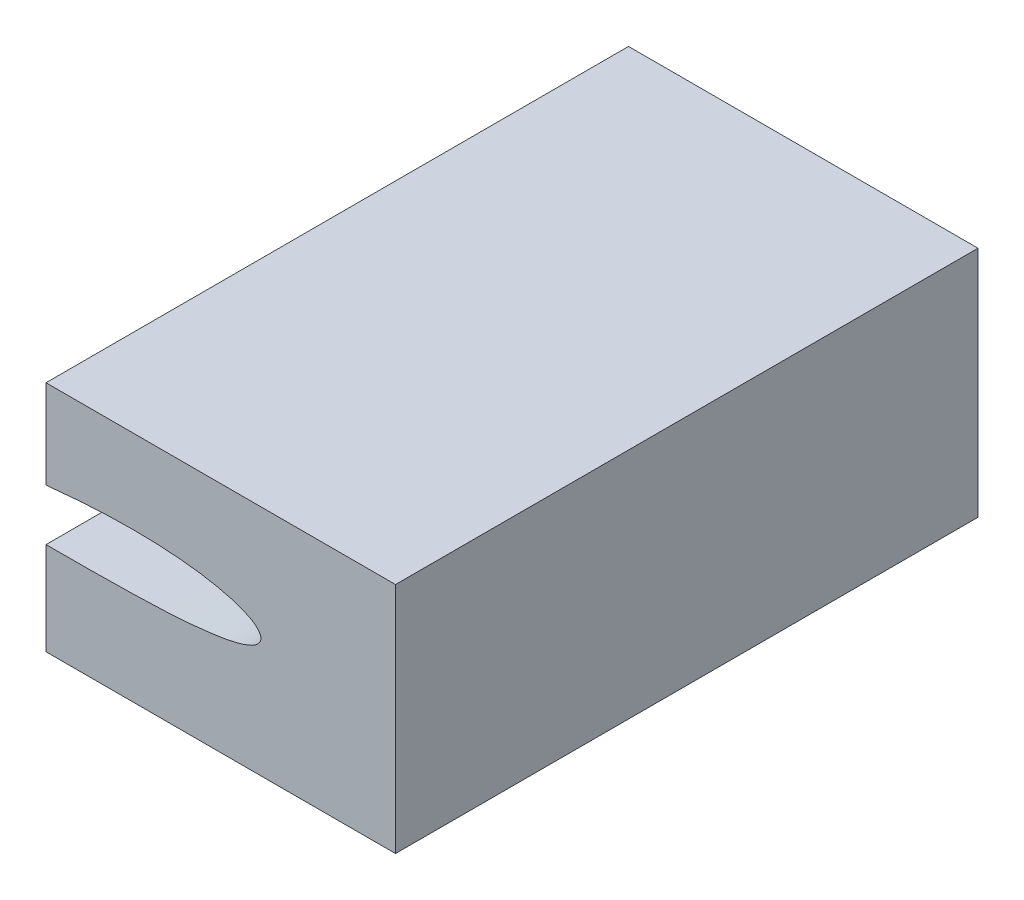
from build123d import *

# Parameters (mm, degrees)
BOSS_EXTRUDE1_DEPTH = 50


with BuildPart() as part:
    # Sketch2 → Boss-Extrude1 (new body)
    with BuildSketch(Plane(origin=(17.440169359, 0, 0), x_dir=(1, 0, 0), z_dir=(0, 0, 1))):
        with BuildLine():
            Line((-17.440169359, 5.390357249), (-17.440169359, 13))
            Line((-17.440169359, 13), (12.559830641, 13))
            Line((12.559830641, 13), (12.559830641, -7))
            Line((12.559830641, -7), (-17.440169359, -7))
            Line((-17.440169359, -7), (-17.440169359, 0.968636761))
            add(Edge.make_bspline(
                [(-17.440169359, 5.390357249), (-16.664935317, 5.470842163), (-14.561128732, 5.666949717), (-11.783536352, 5.82166567), (-9.113416762, 5.827694698), (-7.105746612, 5.753362438), (-5.091431247, 5.584789177), (-3.410557808, 5.342292949), (-2.065932962, 5.043623126), (-1.044165691, 4.763325517), (-0.173974218, 4.422751191), (0.582415766, 3.996804423), (1.259160843, 3.232625666), (0.622534676, 2.507159066), (-0.086213767, 2.158012907), (-0.925619146, 1.879655862), (-1.922357981, 1.662832148), (-3.250283182, 1.456957036), (-4.910940518, 1.270617037), (-6.908929533, 1.137743495), (-8.907757189, 1.056832807), (-11.574700423, 0.999315552), (-14.418956019, 0.965549806), (-16.596594173, 0.965089891), (-17.440169359, 0.968636761)],
                knots=[0.26825455, 0.26825455, 0.26825455, 0.26825455, 0.296916575, 0.345952722, 0.370491626, 0.395091204, 0.419814796, 0.444798575, 0.457489819, 0.470406405, 0.483879409, 0.49126412, 0.503458853, 0.513609129, 0.520450991, 0.533235388, 0.545691039, 0.558031884, 0.582609167, 0.607134742, 0.63165208, 0.656174272, 0.705233949, 0.736257198, 0.736257198, 0.736257198, 0.736257198], degree=3))
        make_face()
    extrude(amount=BOSS_EXTRUDE1_DEPTH)


solid = part.part
